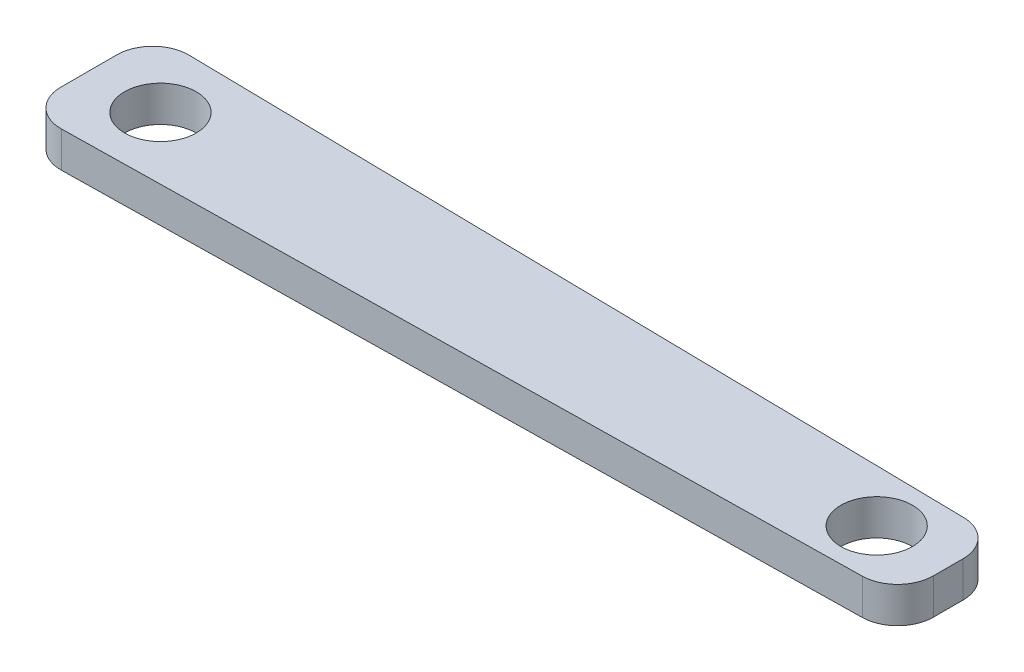
from build123d import *

# Parameters (mm, degrees)
CROQUIS1_R              = 5
SALIENTE_EXTRUIR1_DEPTH = 5
REDONDEO1_R             = 5


with BuildPart() as part:
    # Croquis1 → Saliente-Extruir1 (new body)
    with BuildSketch(Plane(origin=(0, 0, 0), x_dir=(1, 0, 0), z_dir=(0, 1, 0))):
        Polygon((0, 0), (119.999982993, 2), (119.999982993, 16), (0, 18), align=None)
        with Locations(Location((10, 9, 0), (0, 0, 270))):
            Circle(CROQUIS1_R, mode=Mode.SUBTRACT)
        with Locations(Location((110, 9, 0), (0, 0, 270))):
            Circle(CROQUIS1_R, mode=Mode.SUBTRACT)
    extrude(amount=SALIENTE_EXTRUIR1_DEPTH)

    # Redondeo1
    redondeo1_edges = [part.edges().sort_by_distance(p)[0] for p in [
        (0, 2.5, -18),
        (119.999982993, 2.5, -16),
        (119.999982993, 2.5, -2),
        (0, 2.5, 0),
    ]]
    fillet(redondeo1_edges, radius=REDONDEO1_R)


solid = part.part
